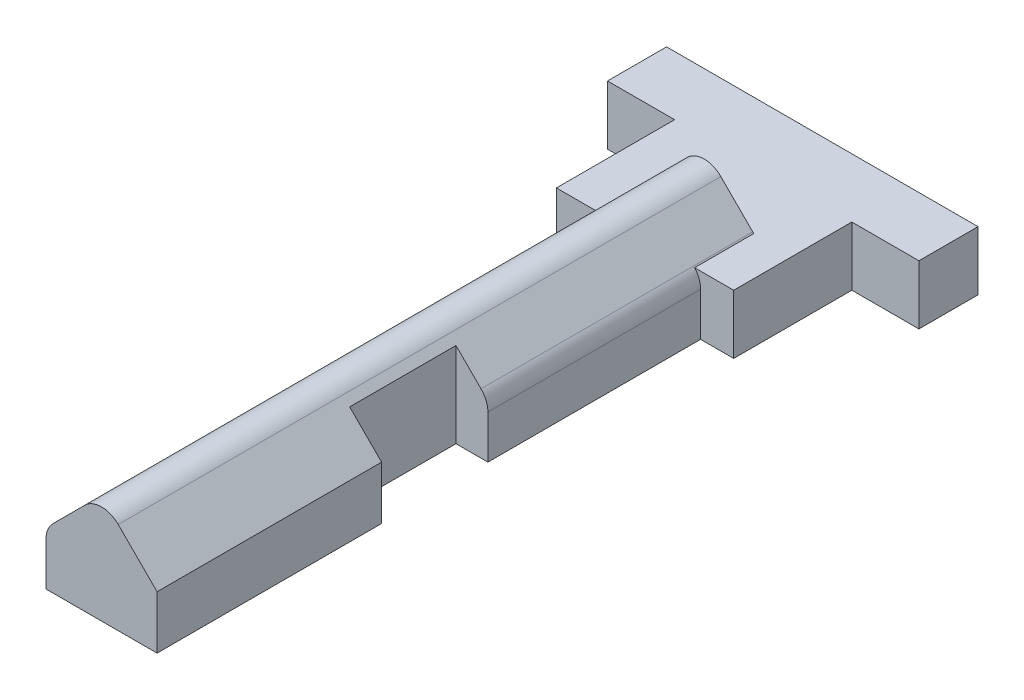
from build123d import *

# Parameters (mm, degrees)
SZKIC1_W                    = 9.4
SZKIC1_H                    = 4.5
DODANIE_WYCI_GNI_CIE1_DEPTH = 51
SZKIC2_W                    = 2.7
SZKIC2_H                    = 9
SZKIC2_W_2                  = 5.3
WYTNIJ_WYCI_GNI_CIE1_DEPTH  = 10
SZKIC4_W                    = 15
SZKIC4_H                    = 10
SZKIC4_W_2                  = 26.356233294
SZKIC4_H_2                  = 5
DODANIE_WYCI_GNI_CIE2_DEPTH = 5
ZAOKR_GLENIE1_R             = 2


with BuildPart() as part:
    # Szkic1 → Dodanie-wyciągnięcie1 (new body)
    with BuildSketch(Plane.XY):
        Polygon((0, 6.95), (4.7, 2.25), (-4.7, 2.25), align=None)
        Rectangle(SZKIC1_W, SZKIC1_H)
    extrude(amount=DODANIE_WYCI_GNI_CIE1_DEPTH)

    # Szkic2 → Wytnij-wyciągnięcie1 (cut)
    with BuildSketch(Plane.XZ.offset(2.25)):
        with Locations((3.35, 27.5)):
            Rectangle(SZKIC2_W, SZKIC2_H)
        with Locations((7.35, 27.5)):
            Rectangle(SZKIC2_W_2, SZKIC2_H)
    extrude(amount=-WYTNIJ_WYCI_GNI_CIE1_DEPTH, mode=Mode.SUBTRACT)

    # Szkic4 → Dodanie-wyciągnięcie2 (add)
    with BuildSketch(Plane.XZ.offset(2.25)):
        Rectangle(SZKIC4_W, SZKIC4_H)
        with Locations((0, -7.5)):
            Rectangle(SZKIC4_W_2, SZKIC4_H_2)
    extrude(amount=-DODANIE_WYCI_GNI_CIE2_DEPTH)

    # Zaokrąglenie1
    zaokr_glenie1_edges = [part.edges().sort_by_distance(p)[0] for p in [
        (4.7, 2.25, 14),
        (-4.7, 2.25, 28),
        (0, 6.95, 25.5),
    ]]
    fillet(zaokr_glenie1_edges, radius=ZAOKR_GLENIE1_R)


solid = part.part
